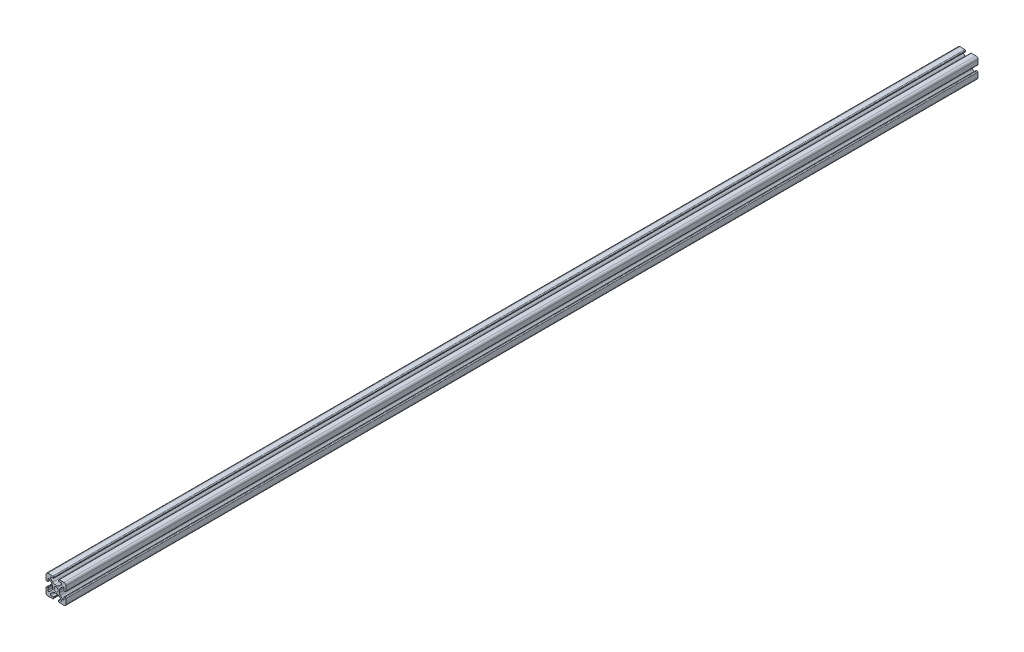
from build123d import *

# Parameters (mm, degrees)
BOSS_EXTRUDE1_DEPTH = 457.2
CIRPATTERN1_COUNT   = 4


with BuildPart() as part:
    # Sketch3 → Boss-Extrude1 (new, symmetric)
    with BuildSketch(Plane.XY):
        with BuildLine():
            Line((-2.524916986, 8.30911066), (-2.500487338, 9.008684239))
            ThreePointArc((-2.500487338, 9.008684239), (-2.714917039, 9.582202525), (-3.272080403, 9.836116498))
            Line((-3.272080403, 9.836116498), (-7.930201007, 9.998781654))
            ThreePointArc((-7.930201007, 9.998781654), (-9.414213562, 9.414213562), (-9.998781654, 7.930201007))
            Line((-9.998781654, 7.930201007), (-9.836116498, 3.272080403))
            ThreePointArc((-9.836116498, 3.272080403), (-9.582202525, 2.714917039), (-9.008684239, 2.500487338))
            Line((-9.008684239, 2.500487338), (-8.30911066, 2.524916986))
            ThreePointArc((-8.30911066, 2.524916986), (-8.100174399, 2.620134726), (-8.019763261, 2.835204083))
            Line((-8.019763261, 2.835204083), (-8.093719461, 4.953032548))
            ThreePointArc((-8.093719461, 4.953032548), (-7.631170264, 5.686128657), (-6.779559917, 5.52444538))
            Line((-6.779559917, 5.52444538), (-4.478679656, 3.22356512))
            ThreePointArc((-4.478679656, 3.22356512), (-3.828361402, 2.250295073), (-3.6, 1.102244776))
            Line((-3.6, 1.102244776), (-3.6, 0))
            Line((-3.6, 0), (-2.15, 0))
            ThreePointArc((-2.15, 0), (-1.52027958, 1.52027958), (0, 2.15))
            Line((0, 2.15), (0, 3.6))
            Line((0, 3.6), (-1.102244776, 3.6))
            ThreePointArc((-1.102244776, 3.6), (-2.250295073, 3.828361402), (-3.22356512, 4.478679656))
            Line((-3.22356512, 4.478679656), (-5.52444538, 6.779559917))
            ThreePointArc((-5.52444538, 6.779559917), (-5.686128657, 7.631170264), (-4.953032548, 8.093719461))
            Line((-4.953032548, 8.093719461), (-2.835204083, 8.019763261))
            ThreePointArc((-2.835204083, 8.019763261), (-2.620134726, 8.100174399), (-2.524916986, 8.30911066))
        make_face()
    boss_extrude1 = extrude(amount=BOSS_EXTRUDE1_DEPTH, both=True)

    # CirPattern1: Boss-Extrude1 ×4 about axis
    cirpattern1_axis = Axis((0, 0, 0), (0, 0, 1))
    for i in range(1, CIRPATTERN1_COUNT):
        add(boss_extrude1.rotate(cirpattern1_axis, i * 360 / CIRPATTERN1_COUNT))


solid = part.part
